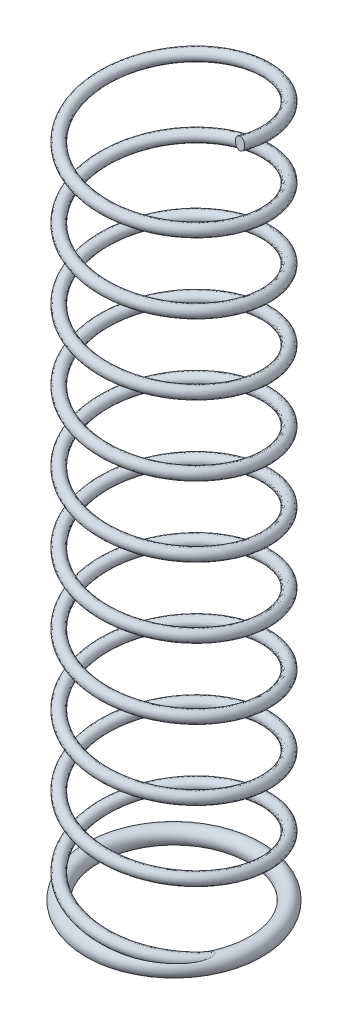
from build123d import *

# Parameters (mm, degrees)
BARRER1_PITCH         = 25
BARRER1_HEIGHT        = 250
BARRER1_RADIUS        = 29
BARRER1_START_ANGLE   = 80
BARRER1_PROFILE_R     = 2
BARRER3_PROFILE_R     = 3
CROQUIS31_R           = 35.558567172
CORTAR_EXTRUIR3_DEPTH = 10


with BuildPart() as part:
    # Barrer1: sweep along a helix
    with BuildLine() as barrer1_path:
        add(Helix(BARRER1_PITCH, BARRER1_HEIGHT, BARRER1_RADIUS, center=(0, 0, 0), direction=(0, 1, 0), lefthand=True, mode=Mode.PRIVATE).rotate(Axis((0, 0, 0), (0, 1, 0)), BARRER1_START_ANGLE))
    # Barrer1 profile (on start of the path) → Barrer1 (sweep)
    with BuildSketch(Plane(origin=(28.559424837, 0, 5.035797152), x_dir=(0.984807753012214, 0, 0.1736481776668967), z_dir=(-0.1720364737837379, 0.13592910102666791, 0.9756673260810466))):
        Circle(BARRER1_PROFILE_R)
    sweep(path=barrer1_path.line, is_frenet=True)

    # Barrer3: sweep along a path in Croquis23
    with BuildLine(Plane(origin=(0, 0, 0), x_dir=(1, 0, 0), z_dir=(0, 1, 0))) as barrer3_path:
        CenterArc((0, 0), 29, 0, 360)
    # Barrer3 profile (on start of the path) → Barrer3 (sweep)
    with BuildSketch(Plane(origin=(29, 0, 0), x_dir=(-1, 0, 0), z_dir=(0, 0, -1))):
        Circle(BARRER3_PROFILE_R)
    sweep(path=barrer3_path.line)

    # Croquis31 → Cortar-Extruir3 (cut)
    with BuildSketch(Plane(origin=(0, -2, 0), x_dir=(1, 0, 0), z_dir=(0, 1, 0))):
        Circle(CROQUIS31_R)
    extrude(amount=-CORTAR_EXTRUIR3_DEPTH, mode=Mode.SUBTRACT)


solid = part.part
